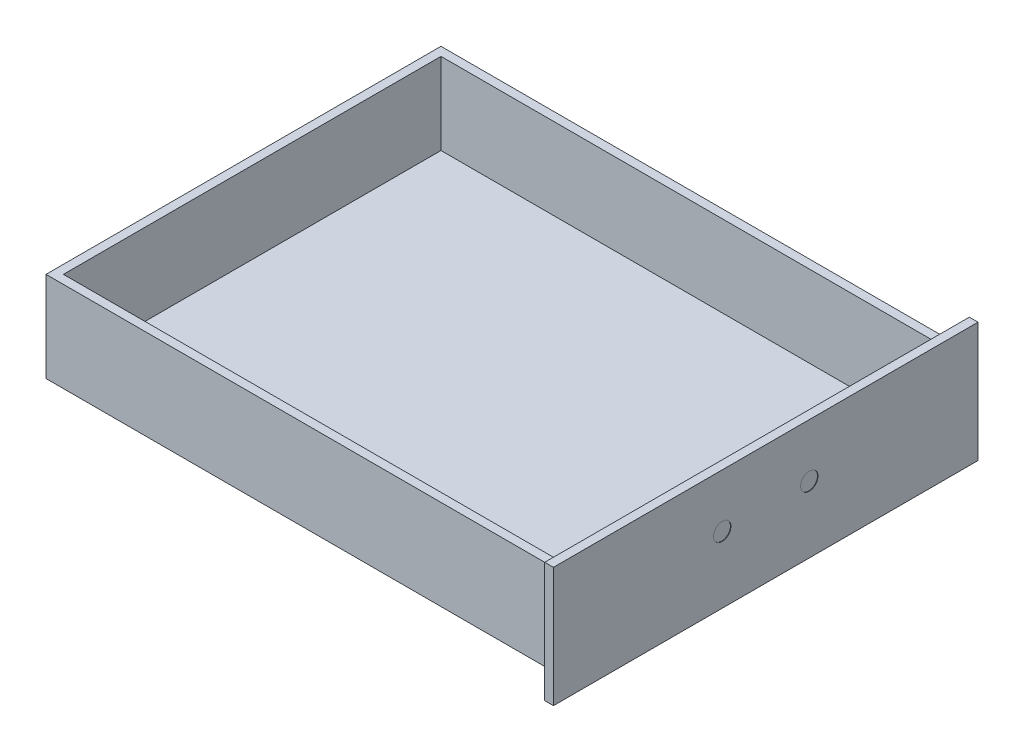
from build123d import *

# Parameters (mm, degrees)
SKETCH1_W           = 487.8
SKETCH1_H           = 137.7
SKETCH1_W_2         = 453.8
SKETCH1_H_2         = 103.7
BOSS_EXTRUDE2_DEPTH = 10
BOSS_EXTRUDE3_DEPTH = 600
SKETCH5_W           = 433.8
SKETCH5_H           = 93.7
BOSS_EXTRUDE4_DEPTH = 10
SKETCH6_W           = 453.8
SKETCH6_H           = 103.7
BOSS_EXTRUDE5_DEPTH = 10
SKETCH7_R           = 25
CUT_EXTRUDE2_DEPTH  = 5
SKETCH8_W           = 116.599055382
SKETCH8_H           = 75.38732029
BOSS_EXTRUDE6_DEPTH = 9
SKETCH9_R           = 10
CUT_EXTRUDE4_DEPTH  = 0.5


with BuildPart() as part:
    # Sketch1 → Boss-Extrude2 (new body)
    with BuildSketch(Plane(origin=(0, 0, 0), x_dir=(0, 0, -1), z_dir=(1, 0, 0))):
        with Locations((124.007003891, -7.666536965)):
            Rectangle(SKETCH1_W, SKETCH1_H)
        with Locations((124.007003891, -7.666536965)):
            Rectangle(SKETCH1_W_2, SKETCH1_H_2, mode=Mode.SUBTRACT)
    extrude(amount=-BOSS_EXTRUDE2_DEPTH)

    # Sketch4 → Boss-Extrude3 (add)
    with BuildSketch(Plane(origin=(0, 0, 0), x_dir=(0, 0, -1), z_dir=(1, 0, 0))):
        Polygon((-92.892996109, -49.516536965), (-92.892996109, 34.183463035), (-92.892996109, 44.183463035), (-102.892996109, 44.183463035), (-102.892996109, -59.516536965), (350.907003891, -59.516536965), (350.907003891, 44.183463035), (340.907003891, 44.183463035), (340.907003891, 34.183463035), (340.907003891, -49.516536965), align=None)
    extrude(amount=-BOSS_EXTRUDE3_DEPTH)

    # Sketch5 → Boss-Extrude4 (add)
    with BuildSketch(Plane(origin=(0, 0, 0), x_dir=(0, 0, -1), z_dir=(1, 0, 0))):
        with Locations((124.007003891, -2.666536965)):
            Rectangle(SKETCH5_W, SKETCH5_H)
    extrude(amount=-BOSS_EXTRUDE4_DEPTH)

    # Sketch6 → Boss-Extrude5 (add)
    with BuildSketch(Plane.ZY.offset(600)):
        with Locations((-124.007003891, -7.666536965)):
            Rectangle(SKETCH6_W, SKETCH6_H)
    extrude(amount=-BOSS_EXTRUDE5_DEPTH)

    # Sketch7 → Cut-Extrude2 (cut)
    with BuildSketch(Plane(origin=(0, 0, 0), x_dir=(0, 0, -1), z_dir=(1, 0, 0))):
        with Locations((124.007003891, -11.609012226)):
            Circle(SKETCH7_R)
    extrude(amount=-CUT_EXTRUDE2_DEPTH, mode=Mode.SUBTRACT)

    # Sketch8 → Boss-Extrude6 (add)
    with BuildSketch(Plane(origin=(0, 0, 0), x_dir=(0, 0, -1), z_dir=(1, 0, 0))):
        with Locations((135.566393002, -11.938485115)):
            Rectangle(SKETCH8_W, SKETCH8_H)
    extrude(amount=-BOSS_EXTRUDE6_DEPTH)

    # Sketch9 → Cut-Extrude4 (cut)
    with BuildSketch(Plane(origin=(0, 0, 0), x_dir=(0, 0, -1), z_dir=(1, 0, 0))):
        with Locations((74.007003891, 0)):
            Circle(SKETCH9_R)
        with Locations((174.007003891, 0)):
            Circle(SKETCH9_R)
    extrude(amount=-CUT_EXTRUDE4_DEPTH, mode=Mode.SUBTRACT)


solid = part.part
